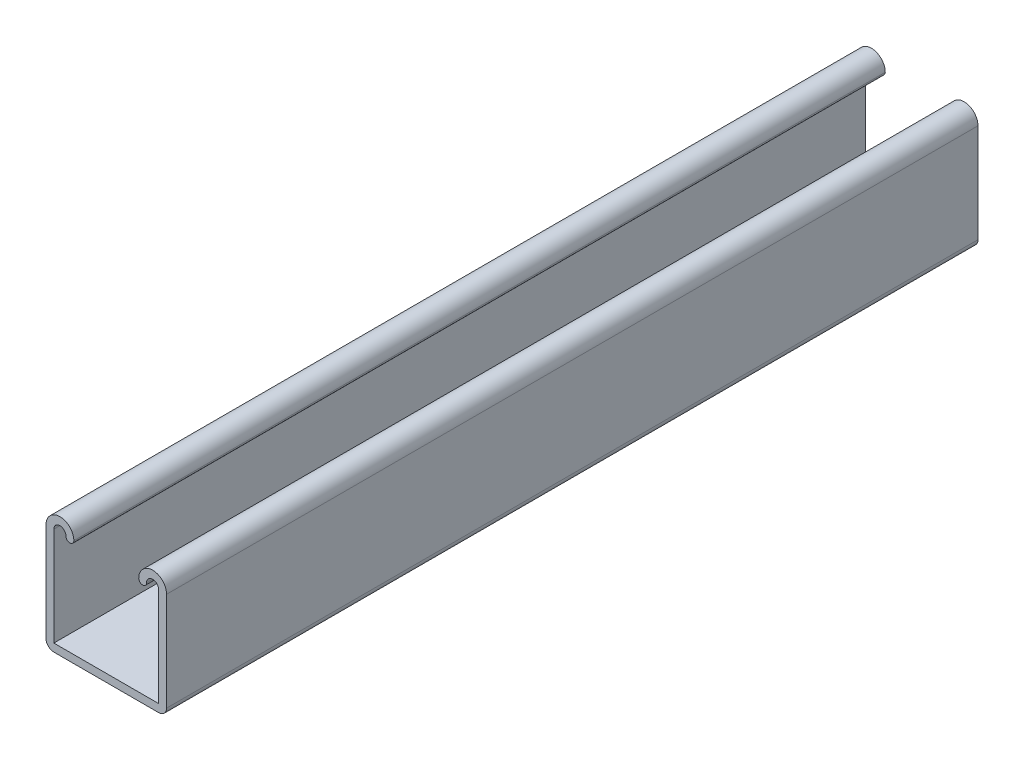
from build123d import *

# Parameters (mm, degrees)
BOSS_EXTRUDE1_DEPTH = 278.384
SKETCH2_R           = 7.112
CUT_EXTRUDE1_DEPTH  = 285.075569203
LPATTERN1_COUNT     = 5
LPATTERN1_PITCH     = 47.752


with BuildPart() as part:
    # Sketch1 → Boss-Extrude1 (new body)
    with BuildSketch(Plane.XY):
        with BuildLine():
            Line((0, 0), (35.98, 0))
            ThreePointArc((35.98, 0), (37.883814298, 0.788585702), (38.6724, 2.6924))
            Line((38.6724, 2.6924), (38.6724, 36.5252))
            ThreePointArc((38.6724, 36.5252), (33.8972, 41.3004), (29.122, 36.5252))
            ThreePointArc((29.122, 36.5252), (30.4682, 35.179), (31.8144, 36.5252))
            ThreePointArc((31.8144, 36.5252), (33.8972, 38.608), (35.98, 36.5252))
            Line((35.98, 36.5252), (35.98, 2.6924))
            Line((35.98, 2.6924), (0, 2.6924))
            Line((0, 2.6924), (0, 36.5252))
            ThreePointArc((0, 36.5252), (2.0828, 38.608), (4.1656, 36.5252))
            ThreePointArc((4.1656, 36.5252), (5.5118, 35.179), (6.858, 36.5252))
            ThreePointArc((6.858, 36.5252), (2.0828, 41.3004), (-2.6924, 36.5252))
            Line((-2.6924, 36.5252), (-2.6924, 2.6924))
            ThreePointArc((-2.6924, 2.6924), (-1.903814298, 0.788585702), (0, 0))
        make_face()
    extrude(amount=BOSS_EXTRUDE1_DEPTH)

    # Sketch2 → Cut-Extrude1 (cut, through all)
    with BuildSketch(Plane(origin=(0, 0, 0), x_dir=(-1, 0, 0), z_dir=(0, -1, 0))):
        with Locations(Location((-17.99, -42.164, 0), (0, 0, 90))):
            Circle(SKETCH2_R)
    cut_extrude1 = extrude(amount=-CUT_EXTRUDE1_DEPTH, mode=Mode.SUBTRACT)

    # LPattern1: Cut-Extrude1 ×5
    with Locations(*[(0, 0, i * LPATTERN1_PITCH) for i in range(1, LPATTERN1_COUNT)]):
        add(cut_extrude1, mode=Mode.SUBTRACT)


solid = part.part
